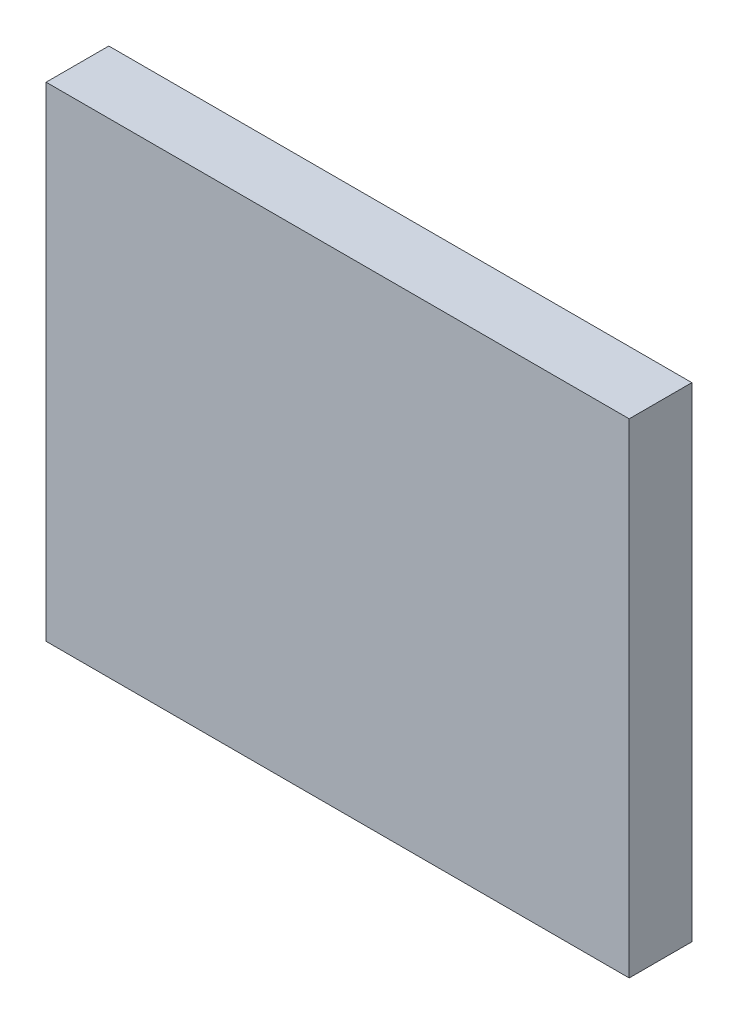
from build123d import *

# Parameters (mm, degrees)
F_1_FR_W        = 93.042145165
F_1_FR_H        = 77.277529207
EXTRUDE_1_DEPTH = 10


with BuildPart() as part:
    # Эскиз1_fr → Бобышка-Вытянуть1 (new body)
    with BuildSketch(Plane.XY):
        with Locations((-2.472880935, -0.618220234)):
            Rectangle(F_1_FR_W, F_1_FR_H)
    extrude(amount=EXTRUDE_1_DEPTH)


solid = part.part
